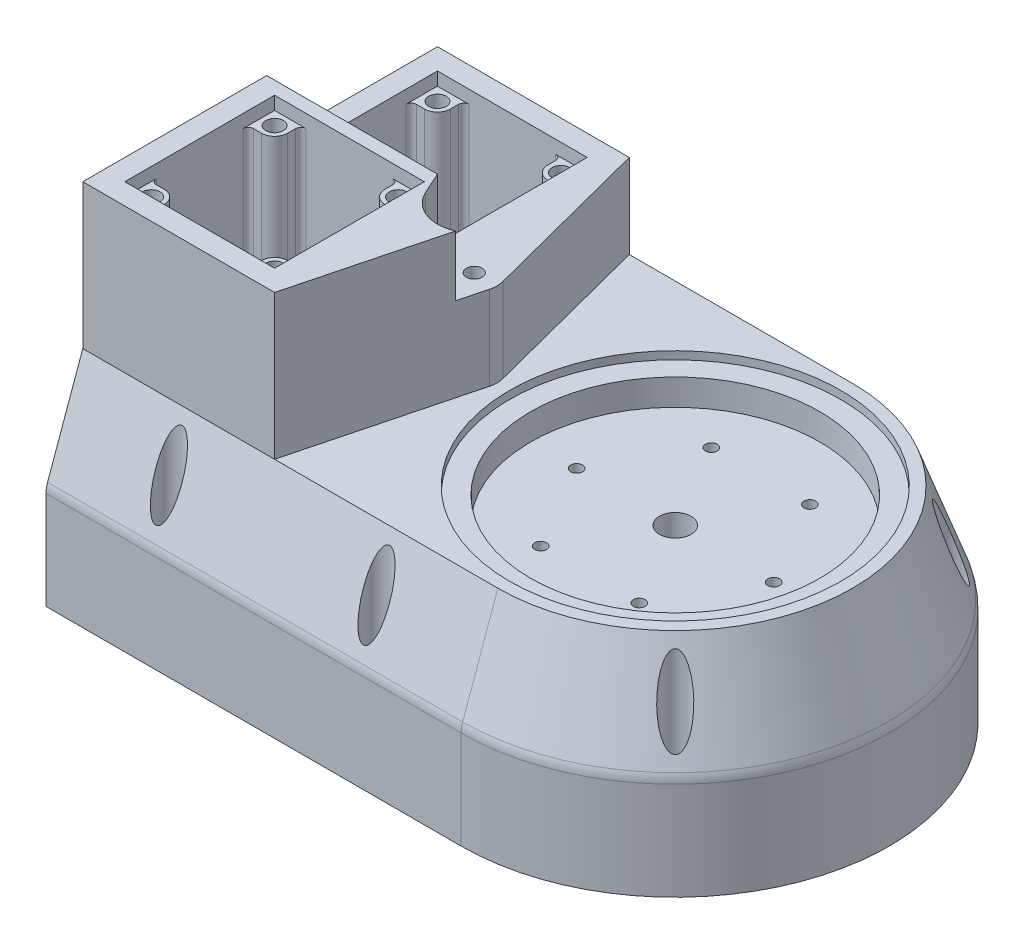
from build123d import *

# Parameters (mm, degrees)
SALIENTE_EXTRUIR1_DEPTH     = 110
CORTAR_EXTRUIR1_DEPTH       = 102
REDONDEO1_R                 = 2
REDONDEO2_R                 = 5
CROQUIS3_W                  = 57
CROQUIS3_H                  = 57
CORTAR_EXTRUIR2_DEPTH       = 5
CROQUIS4_R                  = 6
CORTAR_EXTRUIR3_DEPTH       = 100
CROQUIS5_R                  = 3
CORTAR_EXTRUIR4_DEPTH       = 100
CORTAR_EXTRUIR5_START       = -32
CORTAR_EXTRUIR5_DEPTH       = 32
SALIENTE_EXTRUIR2_DEPTH     = 23
CORTAR_EXTRUIR6_DEPTH       = 102
CROQUIS10_W                 = 57
CROQUIS10_H                 = 57
CORTAR_EXTRUIR7_DEPTH       = 5
CORTAR_EXTRUIR8_DEPTH       = 189.690884782
CORTAR_EXTRUIR8_DEPTH_BACK  = 3
CROQUIS11_R                 = 63
CROQUIS12_R                 = 55
CORTAR_EXTRUIR9_DEPTH       = 13
CROQUIS13_R                 = 1.75
CORTAR_EXTRUIR10_DEPTH      = 14
CROQUIS14_R                 = 2.25
CORTAR_EXTRUIR11_DEPTH      = 5
MATRIZC1_COUNT              = 6
CROQUIS17_R                 = 2.75
CORTAR_EXTRUIR12_DEPTH      = 30
CROQUIS18_R                 = 3.35
CORTAR_EXTRUIR13_DEPTH      = 5
CROQUIS16_R                 = 2.75
CORTAR_EXTRUIR14_DEPTH      = 30
CROQUIS19_R                 = 3.35
CORTAR_EXTRUIR15_DEPTH      = 5
CORTAR_EXTRUIR16_DEPTH      = 202.102585802
CORTAR_EXTRUIR16_DEPTH_BACK = 202.102585802
CROQUIS22_R                 = 3
CORTAR_EXTRUIR17_START      = 30
CROQUIS23_R                 = 5
CORTAR_EXTRUIR17_DEPTH      = 193.025336429


with BuildPart() as part:
    # Croquis1 → Saliente-Extruir1 (new body)
    with BuildSketch(Plane(origin=(0, 0, 0), x_dir=(1, 0, 0), z_dir=(0, 1, 0))):
        with BuildLine():
            Line((-158, 67.5), (0, 67.5))
            ThreePointArc((0, 67.5), (67.5, 0), (0, -67.5))
            Line((0, -67.5), (-158, -67.5))
            Line((-158, -67.5), (-158, 67.5))
        make_face()
    extrude(amount=SALIENTE_EXTRUIR1_DEPTH)

    # Croquis2 → Cortar-Extruir1 (cut)
    with BuildSketch(Plane(origin=(0, 110, 0), x_dir=(1, 0, 0), z_dir=(0, 1, 0))):
        Polygon((-140, 59.5), (-103, 59.5), (-103, 49.5), (-93, 49.5), (-93, 12.5), (-103, 12.5), (-103, 2.5), (-140, 2.5), (-140, 12.5), (-150, 12.5), (-150, 49.5), (-140, 49.5), align=None)
    extrude(amount=-CORTAR_EXTRUIR1_DEPTH, mode=Mode.SUBTRACT)

    # Redondeo1
    redondeo1_edges = [part.edges().sort_by_distance(p)[0] for p in [
        (-150, 59, -12.5),
        (-150, 59, -49.5),
        (-140, 59, -59.5),
        (-103, 59, -59.5),
        (-93, 59, -49.5),
        (-93, 59, -12.5),
        (-103, 59, -2.5),
        (-140, 59, -2.5),
    ]]
    fillet(redondeo1_edges, radius=REDONDEO1_R)

    # Redondeo2
    redondeo2_edges = [part.edges().sort_by_distance(p)[0] for p in [
        (-140, 59, -12.5),
        (-140, 59, -49.5),
        (-103, 59, -49.5),
        (-103, 59, -12.5),
    ]]
    fillet(redondeo2_edges, radius=REDONDEO2_R)

    # Croquis3 → Cortar-Extruir2 (cut)
    with BuildSketch(Plane(origin=(0, 110, 0), x_dir=(1, 0, 0), z_dir=(0, 1, 0))):
        with Locations((-121.5, 31)):
            Rectangle(CROQUIS3_W, CROQUIS3_H)
    extrude(amount=-CORTAR_EXTRUIR2_DEPTH, mode=Mode.SUBTRACT)

    # Croquis4 → Cortar-Extruir3 (cut)
    with BuildSketch(Plane(origin=(0, 110, 0), x_dir=(1, 0, 0), z_dir=(0, 1, 0))):
        with Locations(Location((0, 0, 0), (0, 0, 270))):
            Circle(CROQUIS4_R)
    extrude(amount=-CORTAR_EXTRUIR3_DEPTH, mode=Mode.SUBTRACT)

    # Croquis5 → Cortar-Extruir4 (cut)
    with BuildSketch(Plane(origin=(0, 110, 0), x_dir=(1, 0, 0), z_dir=(0, 1, 0))):
        with Locations(Location((-76.5, 0, 0), (0, 0, 270))):
            Circle(CROQUIS5_R)
    extrude(amount=-CORTAR_EXTRUIR4_DEPTH, mode=Mode.SUBTRACT)

    # Croquis6 → Cortar-Extruir5 (cut)
    with BuildSketch(Plane(origin=(0, 110, 0), x_dir=(1, 0, 0), z_dir=(0, 1, 0)).offset(CORTAR_EXTRUIR5_START)):
        with BuildLine():
            Line((-68.150642634, 2.509621588), (-85, 67.5))
            Line((-85, 67.5), (0, 67.5))
            ThreePointArc((0, 67.5), (67.5, 0), (0, -67.5))
            Line((0, -67.5), (-85, -67.5))
            Line((-85, -67.5), (-68.150642634, -2.509621588))
            ThreePointArc((-68.150642634, -2.509621588), (-67.830611616, 0), (-68.150642634, 2.509621588))
        make_face()
    extrude(amount=CORTAR_EXTRUIR5_DEPTH, mode=Mode.SUBTRACT)

    # Croquis7 → Saliente-Extruir2 (add)
    with BuildSketch(Plane(origin=(0, 110, 0), x_dir=(1, 0, 0), z_dir=(0, 1, 0))):
        with BuildLine():
            Line((-70.817153658, -12.794735536), (-85, -67.5))
            Line((-85, -67.5), (-158, -67.5))
            Line((-158, -67.5), (-158, 2.5))
            Line((-158, 2.5), (-93, 2.5))
            Line((-93, 2.5), (-89.253692234, -5.774368745))
            ThreePointArc((-89.253692234, -5.774368745), (-81.482027989, -13.083554453), (-70.817153658, -12.794735536))
        make_face()
    extrude(amount=SALIENTE_EXTRUIR2_DEPTH)

    # Croquis8 → Cortar-Extruir6 (cut)
    with BuildSketch(Plane(origin=(0, 133, 0), x_dir=(1, 0, 0), z_dir=(0, 1, 0))):
        with BuildLine():
            Line((-105, -59.5), (-138, -59.5))
            ThreePointArc((-138, -59.5), (-139.414213562, -58.914213562), (-140, -57.5))
            Line((-140, -57.5), (-140, -54.5))
            ThreePointArc((-140, -54.5), (-141.464466094, -50.964466094), (-145, -49.5))
            Line((-145, -49.5), (-148, -49.5))
            ThreePointArc((-148, -49.5), (-149.414213562, -48.914213562), (-150, -47.5))
            Line((-150, -47.5), (-150, -14.5))
            ThreePointArc((-150, -14.5), (-149.414213562, -13.085786438), (-148, -12.5))
            Line((-148, -12.5), (-145, -12.5))
            ThreePointArc((-145, -12.5), (-141.464466094, -11.035533906), (-140, -7.5))
            Line((-140, -7.5), (-140, -4.5))
            ThreePointArc((-140, -4.5), (-139.414213562, -3.085786438), (-138, -2.5))
            Line((-138, -2.5), (-105, -2.5))
            ThreePointArc((-105, -2.5), (-103.585786438, -3.085786438), (-103, -4.5))
            Line((-103, -4.5), (-103, -7.5))
            ThreePointArc((-103, -7.5), (-101.535533906, -11.035533906), (-98, -12.5))
            Line((-98, -12.5), (-95, -12.5))
            ThreePointArc((-95, -12.5), (-93.585786438, -13.085786438), (-93, -14.5))
            Line((-93, -14.5), (-93, -47.5))
            ThreePointArc((-93, -47.5), (-93.585786438, -48.914213562), (-95, -49.5))
            Line((-95, -49.5), (-98, -49.5))
            ThreePointArc((-98, -49.5), (-101.535533906, -50.964466094), (-103, -54.5))
            Line((-103, -54.5), (-103, -57.5))
            ThreePointArc((-103, -57.5), (-103.585786438, -58.914213562), (-105, -59.5))
        make_face()
    extrude(amount=-CORTAR_EXTRUIR6_DEPTH, mode=Mode.SUBTRACT)

    # Croquis10 → Cortar-Extruir7 (cut)
    with BuildSketch(Plane(origin=(0, 133, 0), x_dir=(1, 0, 0), z_dir=(0, 1, 0))):
        with Locations((-121.5, -31)):
            Rectangle(CROQUIS10_W, CROQUIS10_H)
    extrude(amount=-CORTAR_EXTRUIR7_DEPTH, mode=Mode.SUBTRACT)

    # Croquis11 → Cortar-Extruir8 (cut, two sides: drawn at the far end of the back side and taken through both)
    with BuildSketch(Plane(origin=(0, 78, 0), x_dir=(1, 0, 0), z_dir=(0, 1, 0)).offset(-CORTAR_EXTRUIR8_DEPTH_BACK)):
        with Locations(Location((0, 0, 0), (0, 0, 270))):
            Circle(CROQUIS11_R)
    extrude(amount=CORTAR_EXTRUIR8_DEPTH + CORTAR_EXTRUIR8_DEPTH_BACK, mode=Mode.SUBTRACT)

    # Croquis12 → Cortar-Extruir9 (cut)
    with BuildSketch(Plane(origin=(0, 78, 0), x_dir=(1, 0, 0), z_dir=(0, 1, 0))):
        with Locations(Location((0, 0, 0), (0, 0, 270))):
            Circle(CROQUIS12_R)
    extrude(amount=-CORTAR_EXTRUIR9_DEPTH, mode=Mode.SUBTRACT)

    # Croquis13 → Cortar-Extruir10 (cut)
    with BuildSketch(Plane(origin=(0, 65, 0), x_dir=(1, 0, 0), z_dir=(0, 1, 0))):
        with Locations(Location((-37.5, 0, 0), (0, 0, 270))):
            Circle(CROQUIS13_R)
    cortar_extruir10 = extrude(amount=-CORTAR_EXTRUIR10_DEPTH, mode=Mode.SUBTRACT)

    # Croquis14 → Cortar-Extruir11 (cut)
    with BuildSketch(Plane(origin=(0, 65, 0), x_dir=(1, 0, 0), z_dir=(0, 1, 0))):
        with Locations(Location((-37.5, 0, 0), (0, 0, 270))):
            Circle(CROQUIS14_R)
    cortar_extruir11 = extrude(amount=-CORTAR_EXTRUIR11_DEPTH, mode=Mode.SUBTRACT)

    # MatrizC1: Cortar-Extruir10, Cortar-Extruir11 ×6 about axis
    matrizc1_axis = Axis((0, 0, 0), (0, 1, 0))
    add([cortar_extruir10.rotate(matrizc1_axis, i * 360 / MATRIZC1_COUNT) for i in range(1, MATRIZC1_COUNT)], mode=Mode.SUBTRACT)
    add([cortar_extruir11.rotate(matrizc1_axis, i * 360 / MATRIZC1_COUNT) for i in range(1, MATRIZC1_COUNT)], mode=Mode.SUBTRACT)

    # Croquis17 → Cortar-Extruir12 (cut)
    with BuildSketch(Plane(origin=(0, 133, 0), x_dir=(1, 0, 0), z_dir=(0, 1, 0))):
        with Locations(Location((-145, -54.5, 0), (0, 0, 270))):
            Circle(CROQUIS17_R)
        with Locations(Location((-98, -54.5, 0), (0, 0, 270))):
            Circle(CROQUIS17_R)
        with Locations(Location((-98, -7.5, 0), (0, 0, 270))):
            Circle(CROQUIS17_R)
        with Locations(Location((-145, -7.5, 0), (0, 0, 270))):
            Circle(CROQUIS17_R)
    extrude(amount=-CORTAR_EXTRUIR12_DEPTH, mode=Mode.SUBTRACT)

    # Croquis18 → Cortar-Extruir13 (cut)
    with BuildSketch(Plane(origin=(0, 128, 0), x_dir=(1, 0, 0), z_dir=(0, 1, 0))):
        with Locations(Location((-145, -7.5, 0), (0, 0, 270))):
            Circle(CROQUIS18_R)
        with Locations(Location((-98, -7.5, 0), (0, 0, 270))):
            Circle(CROQUIS18_R)
        with Locations(Location((-98, -54.5, 0), (0, 0, 270))):
            Circle(CROQUIS18_R)
        with Locations(Location((-145, -54.5, 0), (0, 0, 270))):
            Circle(CROQUIS18_R)
    extrude(amount=-CORTAR_EXTRUIR13_DEPTH, mode=Mode.SUBTRACT)

    # Croquis16 → Cortar-Extruir14 (cut)
    with BuildSketch(Plane(origin=(0, 110, 0), x_dir=(1, 0, 0), z_dir=(0, 1, 0))):
        with Locations(Location((-98, 7.5, 0), (0, 0, 270))):
            Circle(CROQUIS16_R)
        with Locations(Location((-145, 7.5, 0), (0, 0, 270))):
            Circle(CROQUIS16_R)
        with Locations(Location((-98, 54.5, 0), (0, 0, 270))):
            Circle(CROQUIS16_R)
        with Locations(Location((-145, 54.5, 0), (0, 0, 270))):
            Circle(CROQUIS16_R)
    extrude(amount=-CORTAR_EXTRUIR14_DEPTH, mode=Mode.SUBTRACT)

    # Croquis19 → Cortar-Extruir15 (cut)
    with BuildSketch(Plane(origin=(0, 105, 0), x_dir=(1, 0, 0), z_dir=(0, 1, 0))):
        with Locations(Location((-145, 54.5, 0), (0, 0, 270))):
            Circle(CROQUIS19_R)
        with Locations(Location((-98, 54.5, 0), (0, 0, 270))):
            Circle(CROQUIS19_R)
        with Locations(Location((-145, 7.5, 0), (0, 0, 270))):
            Circle(CROQUIS19_R)
        with Locations(Location((-98, 7.5, 0), (0, 0, 270))):
            Circle(CROQUIS19_R)
    extrude(amount=-CORTAR_EXTRUIR15_DEPTH, mode=Mode.SUBTRACT)

    # Barrer1: sweep along a path in Croquis20
    with BuildLine(Plane.XZ) as barrer1_path:
        Line((-158, -67.5), (0, -67.5))
        ThreePointArc((0, -67.5), (67.5, 0), (0, 67.5))
        Line((0, 67.5), (-158, 67.5))
    # Croquis21 → Barrer1 (sweep)
    with BuildSketch(Plane(origin=(-158, 0, 0), x_dir=(0, 0, -1), z_dir=(1, 0, 0))):
        with BuildLine():
            Line((-67.5, 0), (-81.5, 0))
            Line((-81.5, 0), (-81.5, 37.259500921))
            ThreePointArc((-81.5, 37.259500921), (-81.351889846, 38.974221441), (-80.911946708, 40.638148457))
            Line((-80.911946708, 40.638148457), (-67.5, 78))
            Line((-67.5, 78), (-67.5, 39))
            Line((-67.5, 39), (-67.5, 0))
        make_face()
    sweep(path=barrer1_path.line)

    # Croquis22 → Cortar-Extruir16 (cut, two sides: drawn at the far end of the back side and taken through both)
    with BuildSketch(Plane(origin=(0, 39, 0), x_dir=(-1, 0, 0), z_dir=(0, -1, 0)).offset(-CORTAR_EXTRUIR16_DEPTH_BACK)):
        with Locations(Location((118.5, 74.205973354, 0), (0, 0, 90))):
            Circle(CROQUIS22_R)
        with Locations(Location((39.5, 74.205973354, 0), (0, 0, 90))):
            Circle(CROQUIS22_R)
        with Locations(Location((-52.471546963, 52.471546963, 0), (0, 0, 90))):
            Circle(CROQUIS22_R)
        with Locations(Location((118.5, -74.205973354, 0), (0, 0, 270))):
            Circle(CROQUIS22_R)
        with Locations(Location((39.5, -74.205973354, 0), (0, 0, 270))):
            Circle(CROQUIS22_R)
        with Locations(Location((-52.471546963, -52.471546963, 0), (0, 0, 225))):
            Circle(CROQUIS22_R)
    extrude(amount=CORTAR_EXTRUIR16_DEPTH + CORTAR_EXTRUIR16_DEPTH_BACK, mode=Mode.SUBTRACT)

    # Croquis23 → Cortar-Extruir17 (cut, through all)
    with BuildSketch(Plane(origin=(0, 0, 0), x_dir=(1, 0, 0), z_dir=(0, 1, 0)).offset(CORTAR_EXTRUIR17_START)):
        with Locations(Location((-118.5, 74.205973354, 0), (0, 0, 90))):
            Circle(CROQUIS23_R)
        with Locations(Location((-39.5, 74.205973354, 0), (0, 0, 90))):
            Circle(CROQUIS23_R)
        with Locations(Location((52.471546963, 52.471546963, 0), (0, 0, 85.474739491))):
            Circle(CROQUIS23_R)
        with Locations(Location((52.471546963, -52.471546963, 0), (0, 0, 90))):
            Circle(CROQUIS23_R)
        with Locations(Location((-39.5, -74.205973354, 0), (0, 0, 90))):
            Circle(CROQUIS23_R)
        with Locations(Location((-118.5, -74.205973354, 0), (0, 0, 90))):
            Circle(CROQUIS23_R)
    extrude(amount=CORTAR_EXTRUIR17_DEPTH, mode=Mode.SUBTRACT)


solid = part.part
